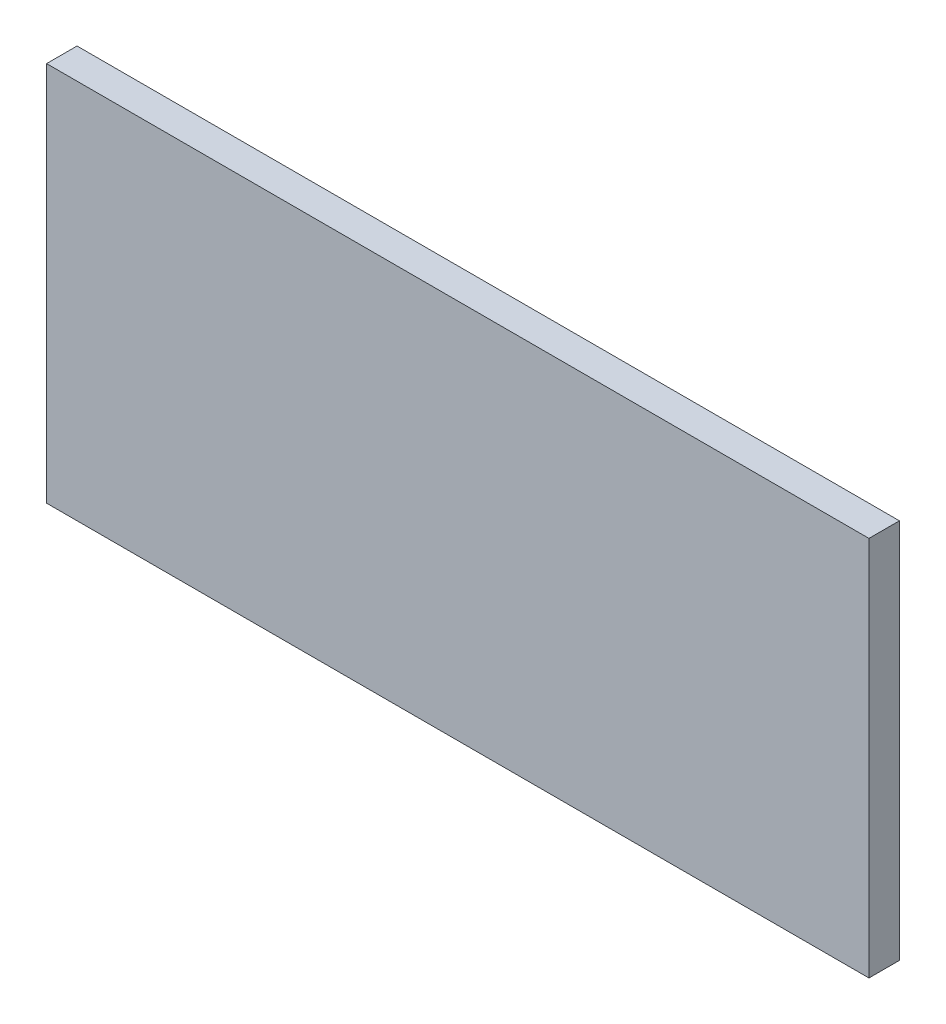
from build123d import *

# Parameters (mm, degrees)
SKETCH1_W           = 540
SKETCH1_H           = 250
BOSS_EXTRUDE1_DEPTH = 20


with BuildPart() as part:
    # Sketch1 → Boss-Extrude1 (new body)
    with BuildSketch(Plane.XY):
        Rectangle(SKETCH1_W, SKETCH1_H)
    extrude(amount=BOSS_EXTRUDE1_DEPTH)


solid = part.part
